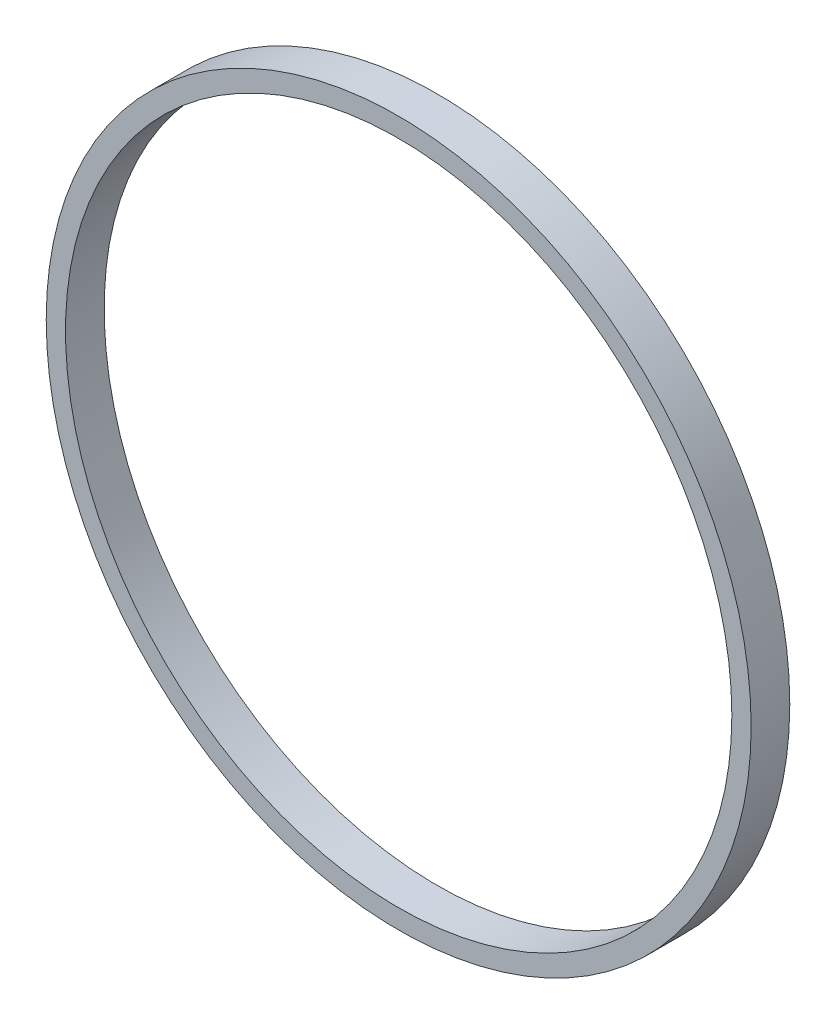
from build123d import *

# Parameters (mm, degrees)
SKETCH1_R           = 46.355
SKETCH1_R_2         = 43.815
BOSS_EXTRUDE1_DEPTH = 5.08


with BuildPart() as part:
    # Sketch1 → Boss-Extrude1 (new body)
    with BuildSketch(Plane.XY):
        Circle(SKETCH1_R)
        Circle(SKETCH1_R_2, mode=Mode.SUBTRACT)
    extrude(amount=BOSS_EXTRUDE1_DEPTH)


solid = part.part
